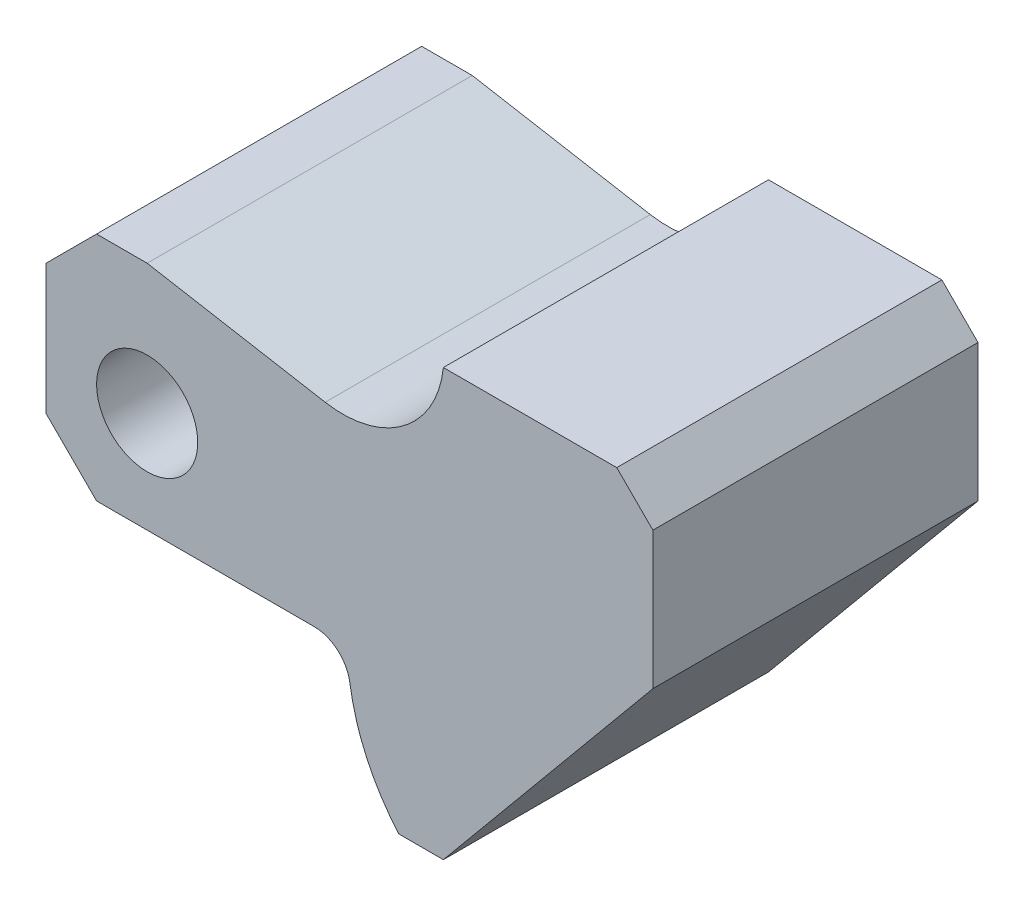
from build123d import *

# Parameters (mm, degrees)
SKETCH1_R           = 7
BOSS_EXTRUDE1_DEPTH = 45


with BuildPart() as part:
    # Sketch1 → Boss-Extrude1 (new body)
    with BuildSketch(Plane.XY):
        with BuildLine():
            ThreePointArc((-42.867935385, -1.633500031), (-39.602699604, -2.846913799), (-37.922296644, -5.898205914))
            ThreePointArc((-37.922296644, -5.898205914), (-35.585466441, -13.749172092), (-31.146494244, -20.633500031))
            Line((-31.146494244, -20.633500031), (-24.980449087, -20.633500031))
            Line((-24.980449087, -20.633500031), (4.019550913, 14.366499969))
            Line((4.019550913, 14.366499969), (4.019550913, 33.366499969))
            Line((4.019550913, 33.366499969), (-0.980449087, 38.366499969))
            Line((-0.980449087, 38.366499969), (-24.980449087, 38.366499969))
            ThreePointArc((-24.980449087, 38.366499969), (-30.471993331, 28.634090038), (-41.337061073, 26.021205766))
            Line((-41.337061073, 26.021205766), (-65.980449087, 30.366499969))
            Line((-65.980449087, 30.366499969), (-72.980449087, 30.366499969))
            Line((-72.980449087, 30.366499969), (-79.980449087, 23.366499969))
            Line((-79.980449087, 23.366499969), (-79.980449087, 5.366499969))
            Line((-79.980449087, 5.366499969), (-72.980449087, -1.633500031))
            Line((-72.980449087, -1.633500031), (-42.867935385, -1.633500031))
        make_face()
        with Locations(Location((-65.980449087, 12.366499969, 0), (0, 0, 180))):
            Circle(SKETCH1_R, mode=Mode.SUBTRACT)
    extrude(amount=BOSS_EXTRUDE1_DEPTH)


solid = part.part
